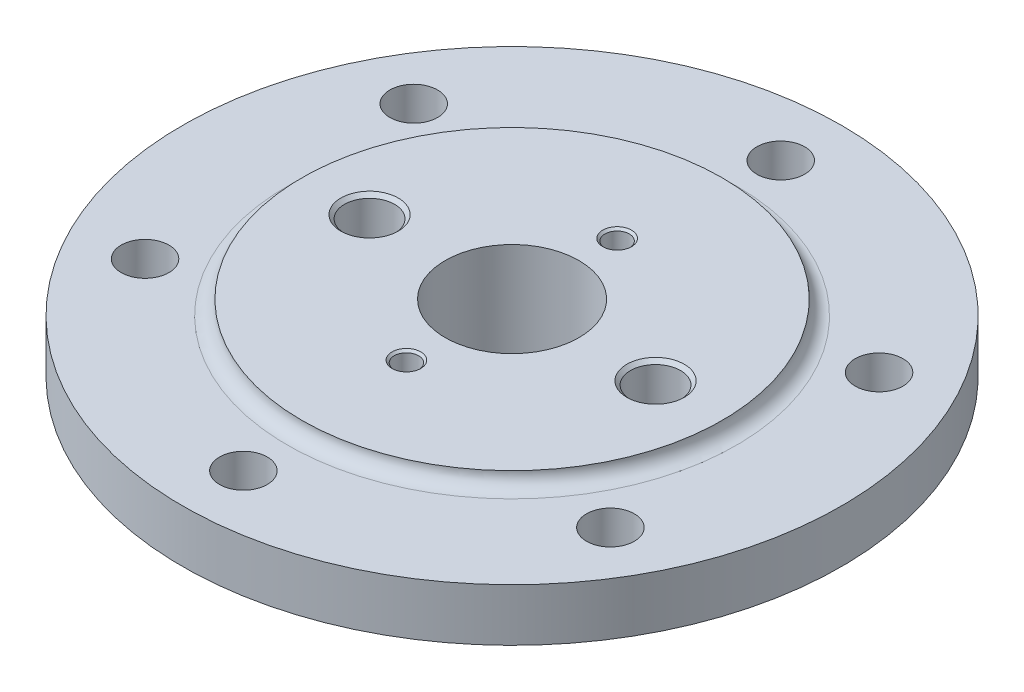
from build123d import *

# Parameters (mm, degrees)
M12_TAPPED_HOLE1_D           = 10.2
M12_TAPPED_HOLE1_DEPTH       = 15
M12_TAPPED_HOLE1_CSINK_D     = 12.05
M12_TAPPED_HOLE1_CSINK_ANGLE = 90
M12_TAPPED_HOLE1_TIP         = 3.064389157
M12_TAPPED_HOLE3_D           = 10.2
M12_TAPPED_HOLE3_DEPTH       = 15
M12_TAPPED_HOLE3_CSINK_D     = 12.05
M12_TAPPED_HOLE3_CSINK_ANGLE = 90
M12_TAPPED_HOLE3_TIP         = 3.064389157
M24_TAPPED_HOLE2_D           = 21
M24_TAPPED_HOLE2_DEPTH       = 33
M24_TAPPED_HOLE2_CSINK_D     = 24.05
M24_TAPPED_HOLE2_CSINK_ANGLE = 90
M24_TAPPED_HOLE2_TIP         = 6.3090365
CUT_EXTRUDE1_REACH           = 211.077
SKETCH3_R                    = 10


with BuildPart() as part:
    # Sketch2 → Revolve1 (revolve)
    with BuildSketch(Plane.XY, mode=Mode.PRIVATE) as revolve1_sk:
        with BuildLine():
            Line((7, 0), (7, 20.875644347))
            Line((7, 20.875644347), (28, 33))
            Line((28, 33), (28, 81))
            Line((28, 81), (88, 81))
            ThreePointArc((88, 81), (89.757359313, 76.757359313), (94, 75))
            Line((94, 75), (138, 75))
            Line((138, 75), (138, 53))
            Line((138, 53), (81, 53))
            Line((81, 53), (81, 47))
            Line((81, 47), (35, 0))
            Line((35, 0), (7, 0))
        make_face()
    revolve(revolve1_sk.sketch.rotate(Axis((0, 0, 0), (0, 1, 0)), 90), axis=Axis((0, 0, 0), (0, 1, 0)))

    # M12 Tapped Hole1
    with Locations(Plane(origin=(0, 81, 0), x_dir=(1, 0, 0), z_dir=(0, 1, 0))):
        with Locations((0.035531834, -44.277728927)):
            CounterSinkHole(M12_TAPPED_HOLE1_D / 2, M12_TAPPED_HOLE1_CSINK_D / 2, depth=M12_TAPPED_HOLE1_DEPTH, counter_sink_angle=M12_TAPPED_HOLE1_CSINK_ANGLE)
            with Locations((0, 0, -(M12_TAPPED_HOLE1_DEPTH + M12_TAPPED_HOLE1_TIP / 2))):  # 118° drill point
                Cone(0, M12_TAPPED_HOLE1_D / 2, M12_TAPPED_HOLE1_TIP, mode=Mode.SUBTRACT)

    # M12 Tapped Hole3
    with Locations(Plane(origin=(0, 81, 0), x_dir=(1, 0, 0), z_dir=(0, 1, 0))):
        with Locations((0, 44)):
            CounterSinkHole(M12_TAPPED_HOLE3_D / 2, M12_TAPPED_HOLE3_CSINK_D / 2, depth=M12_TAPPED_HOLE3_DEPTH, counter_sink_angle=M12_TAPPED_HOLE3_CSINK_ANGLE)
            with Locations((0, 0, -(M12_TAPPED_HOLE3_DEPTH + M12_TAPPED_HOLE3_TIP / 2))):  # 118° drill point
                Cone(0, M12_TAPPED_HOLE3_D / 2, M12_TAPPED_HOLE3_TIP, mode=Mode.SUBTRACT)

    # M24 Tapped Hole2
    with Locations(Plane(origin=(0, 81, 0), x_dir=(1, 0, 0), z_dir=(0, 1, 0))):
        with Locations((59.673816791, 0.403201465), (0, 0), (-60.480219721, 0.80640293)):
            CounterSinkHole(M24_TAPPED_HOLE2_D / 2, M24_TAPPED_HOLE2_CSINK_D / 2, depth=M24_TAPPED_HOLE2_DEPTH, counter_sink_angle=M24_TAPPED_HOLE2_CSINK_ANGLE)
            with Locations((0, 0, -(M24_TAPPED_HOLE2_DEPTH + M24_TAPPED_HOLE2_TIP / 2))):  # 118° drill point
                Cone(0, M24_TAPPED_HOLE2_D / 2, M24_TAPPED_HOLE2_TIP, mode=Mode.SUBTRACT)

    # Sketch3 → Cut-Extrude1 (cut, up to next)
    with BuildSketch(Plane(origin=(0, 75, 0), x_dir=(1, 0, 0), z_dir=(0, 1, 0)), mode=Mode.PRIVATE) as cut_extrude1_sk1:
        with Locations(Location((0, 112.5, 0), (0, 0, 270))):
            Circle(SKETCH3_R)
    cut_extrude1_tool1 = extrude(cut_extrude1_sk1.sketch, amount=-CUT_EXTRUDE1_REACH, mode=Mode.PRIVATE) & part.part
    # Sketch3 → Cut-Extrude1 (cut, up to next)
    with BuildSketch(Plane(origin=(0, 75, 0), x_dir=(1, 0, 0), z_dir=(0, 1, 0)), mode=Mode.PRIVATE) as cut_extrude1_sk2:
        with Locations(Location((97.427857926, 56.25, 0), (0, 0, 270))):
            Circle(SKETCH3_R)
    cut_extrude1_tool2 = extrude(cut_extrude1_sk2.sketch, amount=-CUT_EXTRUDE1_REACH, mode=Mode.PRIVATE) & part.part
    # Sketch3 → Cut-Extrude1 (cut, up to next)
    with BuildSketch(Plane(origin=(0, 75, 0), x_dir=(1, 0, 0), z_dir=(0, 1, 0)), mode=Mode.PRIVATE) as cut_extrude1_sk3:
        with Locations(Location((97.427857926, -56.25, 0), (0, 0, 270))):
            Circle(SKETCH3_R)
    cut_extrude1_tool3 = extrude(cut_extrude1_sk3.sketch, amount=-CUT_EXTRUDE1_REACH, mode=Mode.PRIVATE) & part.part
    # Sketch3 → Cut-Extrude1 (cut, up to next)
    with BuildSketch(Plane(origin=(0, 75, 0), x_dir=(1, 0, 0), z_dir=(0, 1, 0)), mode=Mode.PRIVATE) as cut_extrude1_sk4:
        with Locations(Location((0, -112.5, 0), (0, 0, 270))):
            Circle(SKETCH3_R)
    cut_extrude1_tool4 = extrude(cut_extrude1_sk4.sketch, amount=-CUT_EXTRUDE1_REACH, mode=Mode.PRIVATE) & part.part
    # Sketch3 → Cut-Extrude1 (cut, up to next)
    with BuildSketch(Plane(origin=(0, 75, 0), x_dir=(1, 0, 0), z_dir=(0, 1, 0)), mode=Mode.PRIVATE) as cut_extrude1_sk5:
        with Locations(Location((-97.427857926, -56.25, 0), (0, 0, 270))):
            Circle(SKETCH3_R)
    cut_extrude1_tool5 = extrude(cut_extrude1_sk5.sketch, amount=-CUT_EXTRUDE1_REACH, mode=Mode.PRIVATE) & part.part
    # Sketch3 → Cut-Extrude1 (cut, up to next)
    with BuildSketch(Plane(origin=(0, 75, 0), x_dir=(1, 0, 0), z_dir=(0, 1, 0)), mode=Mode.PRIVATE) as cut_extrude1_sk6:
        with Locations(Location((-97.427857926, 56.25, 0), (0, 0, 270))):
            Circle(SKETCH3_R)
    cut_extrude1_tool6 = extrude(cut_extrude1_sk6.sketch, amount=-CUT_EXTRUDE1_REACH, mode=Mode.PRIVATE) & part.part
    add(cut_extrude1_tool1.solids().sort_by_distance((0, 75, -112.5))[0], mode=Mode.SUBTRACT)
    add(cut_extrude1_tool2.solids().sort_by_distance((97.427858, 75, -56.25))[0], mode=Mode.SUBTRACT)
    add(cut_extrude1_tool3.solids().sort_by_distance((97.427858, 75, 56.25))[0], mode=Mode.SUBTRACT)
    add(cut_extrude1_tool4.solids().sort_by_distance((0, 75, 112.5))[0], mode=Mode.SUBTRACT)
    add(cut_extrude1_tool5.solids().sort_by_distance((-97.427858, 75, 56.25))[0], mode=Mode.SUBTRACT)
    add(cut_extrude1_tool6.solids().sort_by_distance((-97.427858, 75, -56.25))[0], mode=Mode.SUBTRACT)


solid = part.part
